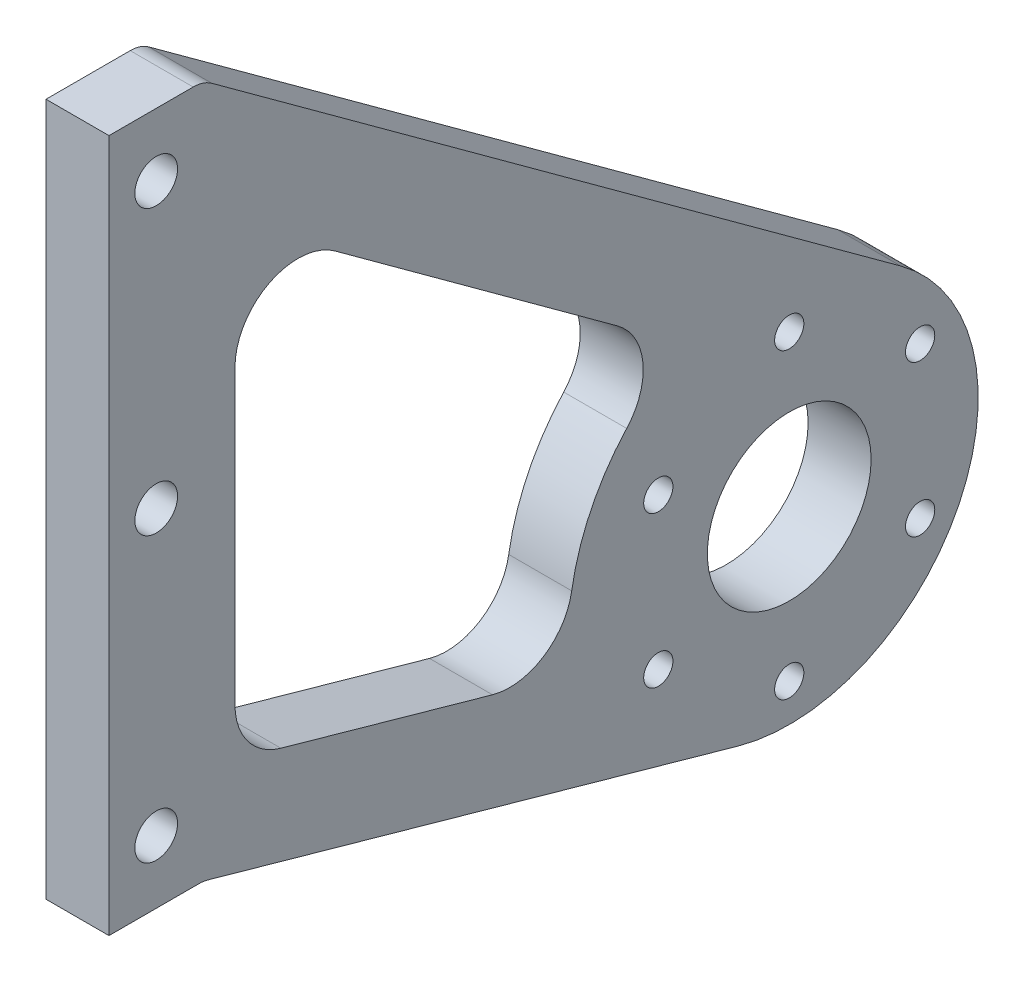
from build123d import *

# Parameters (mm, degrees)
BOSS_EXTRUDE1_DEPTH   = 3.175
SKETCH2_R             = 8.255
CUT_EXTRUDE1_DEPTH    = 102.488814162
F_8_CLEARANCE_HOLE1_D = 4.3053
CIRPATTERN1_COUNT     = 6
FILLET1_R             = 3.175
CUT_EXTRUDE2_DEPTH    = 102.488814162
FILLET2_R             = 6.35


with BuildPart() as part:
    # Sketch1 → Boss-Extrude1 (new, symmetric)
    with BuildSketch(Plane(origin=(0, 0, 0), x_dir=(0, 0, -1), z_dir=(1, 0, 0))):
        with BuildLine():
            Line((0, -34.925), (0, 34.925))
            Line((0, 34.925), (9.525, 34.925))
            Line((9.525, 34.925), (79.8090967, -16.361371494))
            ThreePointArc((79.8090967, -16.361371494), (85.714272022, -40.075816614), (63.420756295, -50.088067084))
            Line((63.420756295, -50.088067084), (9.525, -34.925))
            Line((9.525, -34.925), (0, -34.925))
        make_face()
    extrude(amount=BOSS_EXTRUDE1_DEPTH, both=True)

    # Sketch2 → Cut-Extrude1 (cut, through all)
    with BuildSketch(Plane(origin=(3.175, 0, 0), x_dir=(0, 0, -1), z_dir=(1, 0, 0))):
        with Locations((68.58, -31.75)):
            Circle(SKETCH2_R)
    extrude(amount=-CUT_EXTRUDE1_DEPTH, mode=Mode.SUBTRACT)

    # #8 Clearance Hole1 (through all)
    with Locations(Plane(origin=(3.175, 0, 0), x_dir=(0, 0, -1), z_dir=(1, 0, 0))):
        with Locations((4.7625, 0), (4.7625, 28.575), (4.7625, -28.575)):
            Hole(F_8_CLEARANCE_HOLE1_D / 2)

    # Sketch6 → #4 Clearance Hole1 (revolve, cut)
    with BuildSketch(Plane(origin=(3.175, -16.51, -68.58), x_dir=(0, 0, -1), z_dir=(0, 1, 0))):
        Polygon((0, 0), (0, 7.235187864), (1.4732, 6.35), (1.4732, 0), align=None)
    f_4_clearance_hole1 = revolve(axis=Axis((9.525, -16.51, -68.58), (-1, 0, 0)), mode=Mode.SUBTRACT)

    # CirPattern1: #4 Clearance Hole1 ×6 about axis
    cirpattern1_axis = Axis((0, -31.75, -68.58), (1, 0, 0))
    for i in range(1, CIRPATTERN1_COUNT):
        add(f_4_clearance_hole1.rotate(cirpattern1_axis, i * 360 / CIRPATTERN1_COUNT), mode=Mode.SUBTRACT)

    # Fillet1
    fillet1_edges = [part.edges().sort_by_distance(p)[0] for p in [
        (0, 34.925, -9.525),
        (0, -34.925, -9.525),
    ]]
    fillet(fillet1_edges, radius=FILLET1_R)

    # Sketch8 → Cut-Extrude2 (cut, through all)
    with BuildSketch(Plane(origin=(3.175, 0, 0), x_dir=(0, 0, -1), z_dir=(1, 0, 0))):
        with BuildLine():
            Line((12.7, -25.923470533), (12.7, 20.816944046))
            Line((12.7, 20.816944046), (57.973509635, -12.219178534))
            ThreePointArc((57.973509635, -12.219178534), (48.590015975, -22.036547283), (46.67035819, -35.480713171))
            Line((46.67035819, -35.480713171), (12.7, -25.923470533))
        make_face()
    extrude(amount=-CUT_EXTRUDE2_DEPTH, mode=Mode.SUBTRACT)

    # Fillet2
    fillet2_edges = [part.edges().sort_by_distance(p)[0] for p in [
        (0, -35.480713171, -46.67035819),
        (0, -25.923470533, -12.7),
        (0, 20.816944046, -12.7),
        (0, -12.219178534, -57.973509635),
    ]]
    fillet(fillet2_edges, radius=FILLET2_R)


solid = part.part
